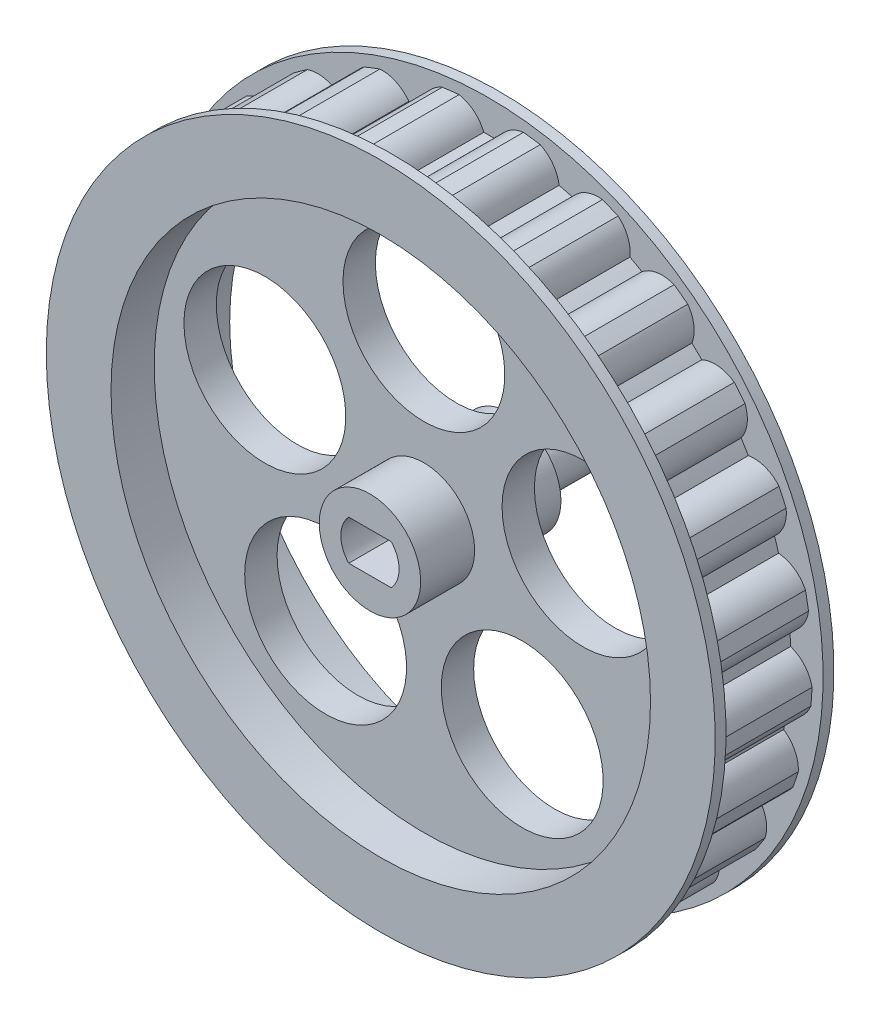
from build123d import *

# Parameters (mm, degrees)
CUT_EXTRUDE1_DEPTH       = 44.370496884
CIRPATTERN1_COUNT        = 25
SKETCH3_R                = 7.5
CUT_EXTRUDE2_DEPTH       = 43.84000856
CIRPATTERN2_COUNT        = 5
BOSS_EXTRUDE1_START      = 1
SKETCH4_R                = 31
SKETCH4_R_2              = 25
BOSS_EXTRUDE1_DEPTH      = 1
BOSS_EXTRUDE2_START      = 5
SKETCH5_R                = 4.7
SKETCH5_R_2              = 2.7
BOSS_EXTRUDE2_DEPTH      = 5
BOSS_EXTRUDE3_DEPTH      = 13
BOSS_EXTRUDE4_DEPTH      = 8
BOSS_EXTRUDE4_DEPTH_BACK = 3.6
SKETCH7_R                = 2.7


with BuildPart() as part:
    # Sketch1 → Revolve1 (revolve)
    with BuildSketch(Plane(origin=(0, 0, 0), x_dir=(0, 0, -1), z_dir=(1, 0, 0)), mode=Mode.PRIVATE) as revolve1_sk:
        Polygon((-4.5, 25), (-1.5, 25), (-1.5, 2.7), (1.5, 2.7), (1.5, 25), (4.5, 25), (4.5, 30), (-4.5, 30), align=None)
    revolve(revolve1_sk.sketch.rotate(Axis((0, 0, 3.054222254), (0, 0, -1)), 90), axis=Axis((0, 0, 3.054222254), (0, 0, -1)))

    # Sketch2 → Cut-Extrude1 (cut, through all)
    with BuildSketch(Plane(origin=(0, 0, -4.5), x_dir=(-1, 0, 0), z_dir=(0, 0, -1))):
        with BuildLine():
            ThreePointArc((0.450015258, 27.99638345), (-0.18373464, 27.999397165), (-0.817390411, 27.988066616))
            ThreePointArc((-0.817390411, 27.988066616), (-1.770903861, 29.232790202), (-3.222137334, 29.826461926))
            ThreePointArc((-3.222137334, 29.826461926), (-0.243371977, 29.999012818), (2.73780082, 29.874812914))
            ThreePointArc((2.73780082, 29.874812914), (1.353306055, 29.228633271), (0.450015258, 27.99638345))
        make_face()
    cut_extrude1 = extrude(amount=-CUT_EXTRUDE1_DEPTH, mode=Mode.SUBTRACT)

    # CirPattern1: Cut-Extrude1 ×25 about axis
    cirpattern1_axis = Axis((0, 0, 0), (0, 0, 1))
    for i in range(1, CIRPATTERN1_COUNT):
        add(cut_extrude1.rotate(cirpattern1_axis, i * 360 / CIRPATTERN1_COUNT), mode=Mode.SUBTRACT)

    # Sketch3 → Cut-Extrude2 (cut, through all)
    with BuildSketch(Plane(origin=(0, 0, -1.5), x_dir=(-1, 0, 0), z_dir=(0, 0, -1))):
        with Locations((0, 15.5)):
            Circle(SKETCH3_R)
    cut_extrude2 = extrude(amount=-CUT_EXTRUDE2_DEPTH, mode=Mode.SUBTRACT)

    # CirPattern2: Cut-Extrude2 ×5 about axis
    cirpattern2_axis = Axis((0, 0, 0), (0, 0, 1))
    for i in range(1, CIRPATTERN2_COUNT):
        add(cut_extrude2.rotate(cirpattern2_axis, i * 360 / CIRPATTERN2_COUNT), mode=Mode.SUBTRACT)

    # Sketch4 → Boss-Extrude1 (add)
    with BuildSketch(Plane(origin=(0, 0, -4.5), x_dir=(-1, 0, 0), z_dir=(0, 0, -1)).offset(BOSS_EXTRUDE1_START)):
        Circle(SKETCH4_R)
        with Locations(Location((0, 0, 0), (0, 0, 180))):
            Circle(SKETCH4_R_2, mode=Mode.SUBTRACT)
    boss_extrude1 = extrude(amount=-BOSS_EXTRUDE1_DEPTH)

    # Sketch5 → Boss-Extrude2 (add)
    with BuildSketch(Plane(origin=(0, 0, -1.5), x_dir=(-1, 0, 0), z_dir=(0, 0, -1)).offset(BOSS_EXTRUDE2_START)):
        with Locations(Location((0, 0, 0), (0, 0, 180))):
            Circle(SKETCH5_R)
        with Locations(Location((0, 0, 0), (0, 0, 180))):
            Circle(SKETCH5_R_2, mode=Mode.SUBTRACT)
    boss_extrude2 = extrude(amount=-BOSS_EXTRUDE2_DEPTH)

    # Mirror2: Boss-Extrude2 across plane
    add(boss_extrude2.mirror(Plane.XY))

    # Mirror3: Boss-Extrude1 across plane
    add(boss_extrude1.mirror(Plane.XY))

    # Sketch6 → Boss-Extrude3 (add, through all)
    with BuildSketch(Plane(origin=(0, 0, -6.5), x_dir=(-1, 0, 0), z_dir=(0, 0, -1))):
        with BuildLine():
            Line((-1.966596044, 1.85), (1.966596044, 1.85))
            ThreePointArc((1.966596044, 1.85), (0, 2.7), (-1.966596044, 1.85))
        make_face()
        with BuildLine():
            Line((-1.966596044, -1.85), (1.966596044, -1.85))
            ThreePointArc((1.966596044, -1.85), (0, -2.7), (-1.966596044, -1.85))
        make_face()
    extrude(amount=-BOSS_EXTRUDE3_DEPTH)

    # Sketch7 → Boss-Extrude4 (add, two sides: drawn at the far end of the back side and taken through both)
    with BuildSketch(Plane(origin=(0, 0, -6.5), x_dir=(-1, 0, 0), z_dir=(0, 0, -1)).offset(-BOSS_EXTRUDE4_DEPTH_BACK)):
        Circle(SKETCH7_R)
    extrude(amount=BOSS_EXTRUDE4_DEPTH + BOSS_EXTRUDE4_DEPTH_BACK)


solid = part.part
